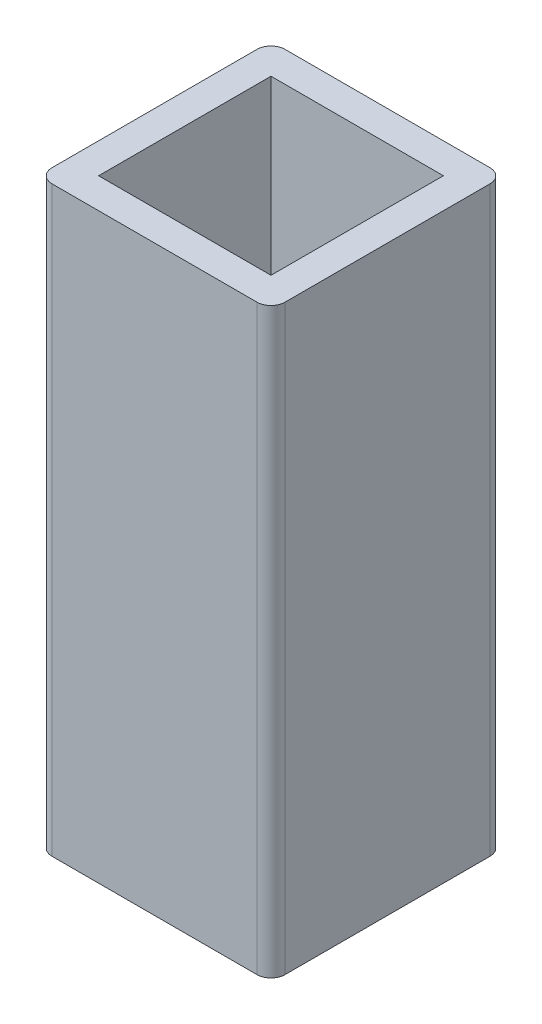
from build123d import *

# Parameters (mm, degrees)
SKETCH1_W           = 9.398
SKETCH1_H           = 9.398
BOSS_EXTRUDE1_DEPTH = 31.75


with BuildPart() as part:
    # Sketch1 → Boss-Extrude1 (new body)
    with BuildSketch(Plane(origin=(0, 0, 0), x_dir=(1, 0, 0), z_dir=(0, 1, 0))):
        with BuildLine():
            Line((-5.588, -6.35), (5.588, -6.35))
            ThreePointArc((5.588, -6.35), (6.126815367, -6.126815367), (6.35, -5.588))
            Line((6.35, -5.588), (6.35, 5.588))
            ThreePointArc((6.35, 5.588), (6.126815367, 6.126815367), (5.588, 6.35))
            Line((5.588, 6.35), (-5.588, 6.35))
            ThreePointArc((-5.588, 6.35), (-6.126815367, 6.126815367), (-6.35, 5.588))
            Line((-6.35, 5.588), (-6.35, -5.588))
            ThreePointArc((-6.35, -5.588), (-6.126815367, -6.126815367), (-5.588, -6.35))
        make_face()
        Rectangle(SKETCH1_W, SKETCH1_H, mode=Mode.SUBTRACT)
    extrude(amount=BOSS_EXTRUDE1_DEPTH)


solid = part.part
